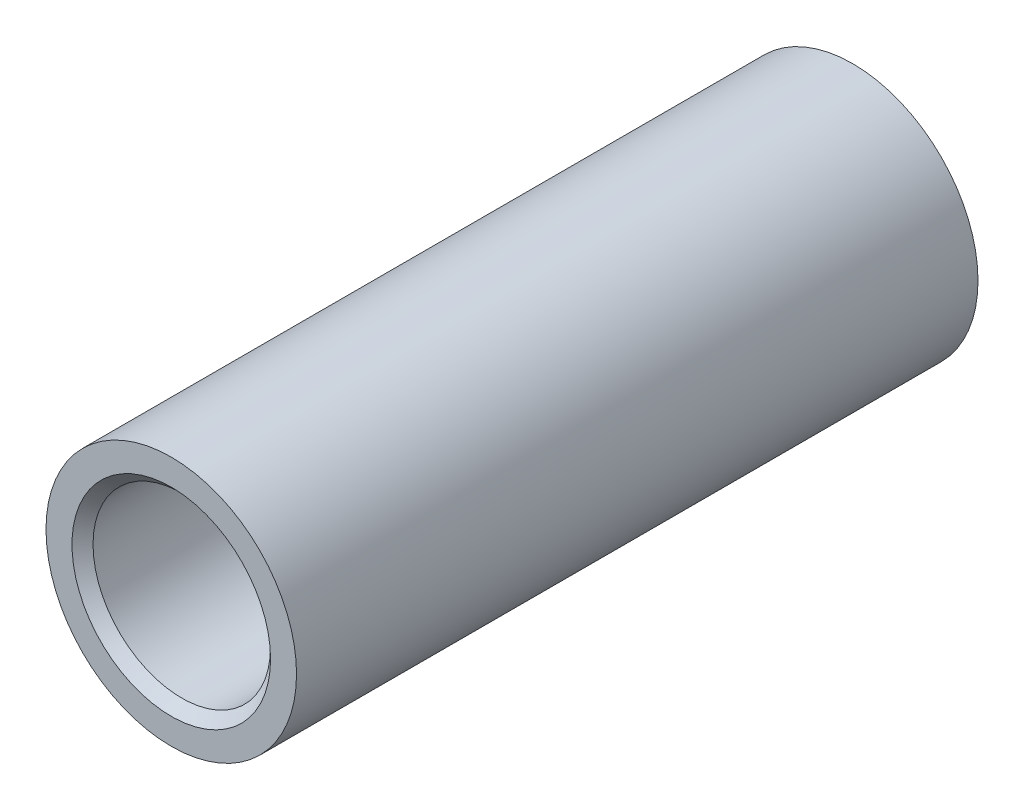
from build123d import *

# Parameters (mm, degrees)
SKETCH1_R           = 4.7625
SKETCH1_R_2         = 3.375
BOSS_EXTRUDE1_DEPTH = 25.908
CHAMFER1_SIZE       = 0.4


with BuildPart() as part:
    # Sketch1 → Boss-Extrude1 (new body)
    with BuildSketch(Plane.XY):
        Circle(SKETCH1_R)
        Circle(SKETCH1_R_2, mode=Mode.SUBTRACT)
    extrude(amount=BOSS_EXTRUDE1_DEPTH)

    # Chamfer1
    chamfer1_edges = [part.edges().sort_by_distance(p)[0] for p in [
        (-3.375, 0, 0),
        (-3.375, 0, 25.908),
    ]]
    chamfer(chamfer1_edges, length=CHAMFER1_SIZE)


solid = part.part
